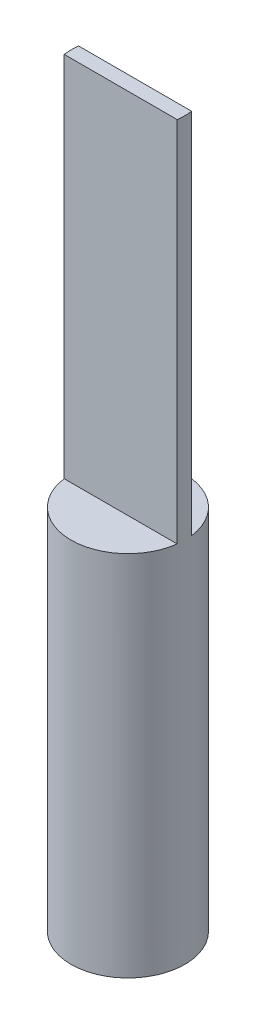
from build123d import *

# Parameters (mm, degrees)
SKETCH1_R           = 3.937
BOSS_EXTRUDE1_DEPTH = 50.8
SKETCH2_W           = 10.332995963
SKETCH2_H           = 3.744881909
CUT_EXTRUDE1_DEPTH  = 25.4


with BuildPart() as part:
    # Sketch1 → Boss-Extrude1 (new body)
    with BuildSketch(Plane(origin=(0, 0, 0), x_dir=(1, 0, 0), z_dir=(0, 1, 0))):
        with Locations(Location((0, 0, 0), (0, 0, 270))):
            Circle(SKETCH1_R)
    extrude(amount=BOSS_EXTRUDE1_DEPTH)

    # Sketch2 → Cut-Extrude1 (cut)
    with BuildSketch(Plane(origin=(0, 50.8, 0), x_dir=(1, 0, 0), z_dir=(0, 1, 0))):
        with Locations((0.308718685, -2.372440955)):
            Rectangle(SKETCH2_W, SKETCH2_H)
        with Locations((0.308718685, 2.372440955)):
            Rectangle(SKETCH2_W, SKETCH2_H)
    extrude(amount=-CUT_EXTRUDE1_DEPTH, mode=Mode.SUBTRACT)


solid = part.part
